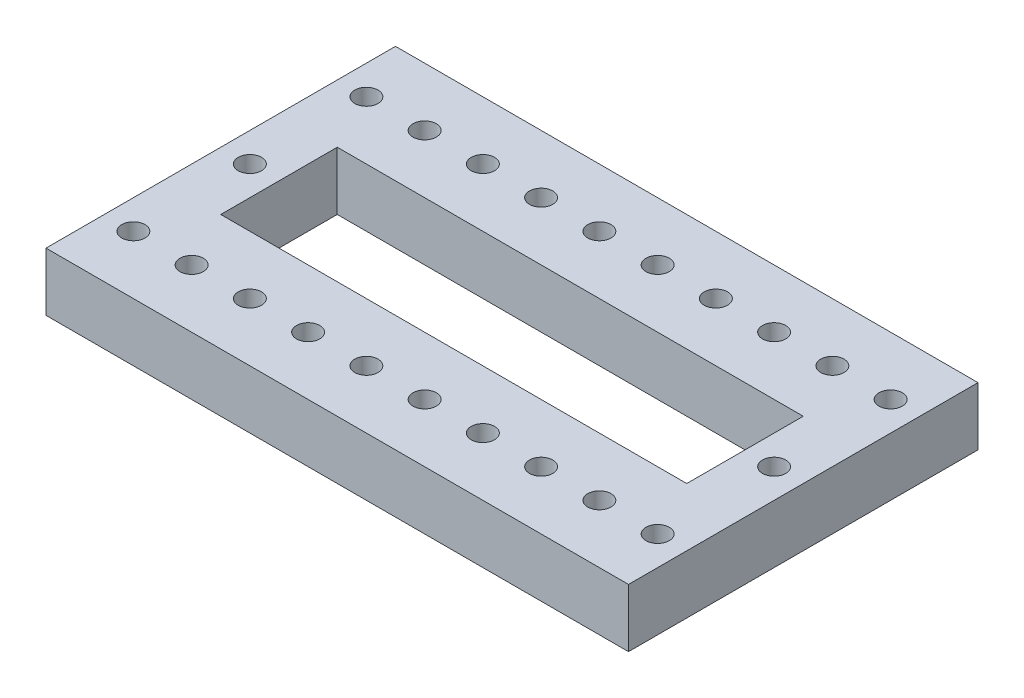
from build123d import *

# Parameters (mm, degrees)
SKETCH1_W           = 100
SKETCH1_H           = 60
SKETCH1_R           = 2
SKETCH1_W_2         = 80
SKETCH1_H_2         = 20
BOSS_EXTRUDE1_DEPTH = 10


with BuildPart() as part:
    # Sketch1 → Boss-Extrude1 (new body)
    with BuildSketch(Plane(origin=(0, 0, 0), x_dir=(1, 0, 0), z_dir=(0, 1, 0))):
        with Locations((50, 30)):
            Rectangle(SKETCH1_W, SKETCH1_H)
        with Locations(Location((5, 30, 0), (0, 0, 270))):
            Circle(SKETCH1_R, mode=Mode.SUBTRACT)
        with Locations(Location((5, 50, 0), (0, 0, 270))):
            Circle(SKETCH1_R, mode=Mode.SUBTRACT)
        with Locations(Location((5, 10, 0), (0, 0, 270))):
            Circle(SKETCH1_R, mode=Mode.SUBTRACT)
        with Locations(Location((15, 50, 0), (0, 0, 270))):
            Circle(SKETCH1_R, mode=Mode.SUBTRACT)
        with Locations(Location((15, 10, 0), (0, 0, 270))):
            Circle(SKETCH1_R, mode=Mode.SUBTRACT)
        with Locations(Location((25, 50, 0), (0, 0, 270))):
            Circle(SKETCH1_R, mode=Mode.SUBTRACT)
        with Locations(Location((25, 10, 0), (0, 0, 270))):
            Circle(SKETCH1_R, mode=Mode.SUBTRACT)
        with Locations(Location((35, 50, 0), (0, 0, 270))):
            Circle(SKETCH1_R, mode=Mode.SUBTRACT)
        with Locations(Location((35, 10, 0), (0, 0, 270))):
            Circle(SKETCH1_R, mode=Mode.SUBTRACT)
        with Locations(Location((45, 50, 0), (0, 0, 270))):
            Circle(SKETCH1_R, mode=Mode.SUBTRACT)
        with Locations(Location((45, 10, 0), (0, 0, 270))):
            Circle(SKETCH1_R, mode=Mode.SUBTRACT)
        with Locations(Location((55, 50, 0), (0, 0, 270))):
            Circle(SKETCH1_R, mode=Mode.SUBTRACT)
        with Locations(Location((55, 10, 0), (0, 0, 270))):
            Circle(SKETCH1_R, mode=Mode.SUBTRACT)
        with Locations(Location((65, 50, 0), (0, 0, 270))):
            Circle(SKETCH1_R, mode=Mode.SUBTRACT)
        with Locations(Location((65, 10, 0), (0, 0, 270))):
            Circle(SKETCH1_R, mode=Mode.SUBTRACT)
        with Locations(Location((75, 50, 0), (0, 0, 270))):
            Circle(SKETCH1_R, mode=Mode.SUBTRACT)
        with Locations(Location((75, 10, 0), (0, 0, 270))):
            Circle(SKETCH1_R, mode=Mode.SUBTRACT)
        with Locations(Location((85, 50, 0), (0, 0, 270))):
            Circle(SKETCH1_R, mode=Mode.SUBTRACT)
        with Locations(Location((85, 10, 0), (0, 0, 270))):
            Circle(SKETCH1_R, mode=Mode.SUBTRACT)
        with Locations(Location((95, 50, 0), (0, 0, 270))):
            Circle(SKETCH1_R, mode=Mode.SUBTRACT)
        with Locations(Location((95, 10, 0), (0, 0, 270))):
            Circle(SKETCH1_R, mode=Mode.SUBTRACT)
        with Locations(Location((95, 30, 0), (0, 0, 270))):
            Circle(SKETCH1_R, mode=Mode.SUBTRACT)
        with Locations((50, 30)):
            Rectangle(SKETCH1_W_2, SKETCH1_H_2, mode=Mode.SUBTRACT)
    extrude(amount=BOSS_EXTRUDE1_DEPTH)


solid = part.part
